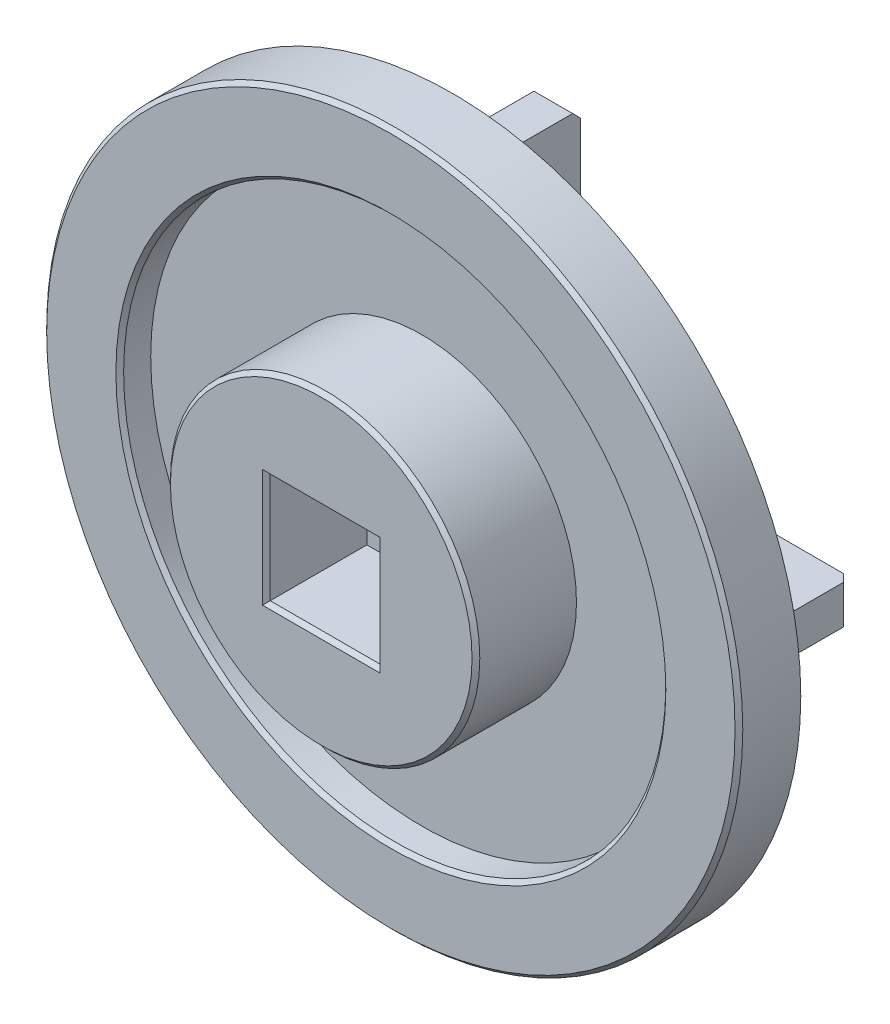
from build123d import *

# Parameters (mm, degrees)
SKETCH1_R           = 45
BOSS_EXTRUDE1_DEPTH = 8
SKETCH2_R           = 35.05
CUT_EXTRUDE1_DEPTH  = 4
SKETCH3_R           = 20
SKETCH3_W           = 14.2
SKETCH3_H           = 14.2
BOSS_EXTRUDE2_DEPTH = 13
CHAMFER1_SIZE       = 0.5
BOSS_EXTRUDE3_DEPTH = 14
CHAMFER3_SIZE       = 1
FILLET1_R           = 1


with BuildPart() as part:
    # Sketch1 → Boss-Extrude1 (new body)
    with BuildSketch(Plane.XY):
        Circle(SKETCH1_R)
    extrude(amount=BOSS_EXTRUDE1_DEPTH)

    # Sketch2 → Cut-Extrude1 (cut)
    with BuildSketch(Plane.XY.offset(8)):
        Circle(SKETCH2_R)
    extrude(amount=-CUT_EXTRUDE1_DEPTH, mode=Mode.SUBTRACT)

    # Sketch3 → Boss-Extrude2 (add)
    with BuildSketch(Plane.XY.offset(4)):
        with Locations(Location((0, 0, 0), (0, 0, 180))):
            Circle(SKETCH3_R)
        Rectangle(SKETCH3_W, SKETCH3_H, mode=Mode.SUBTRACT)
    extrude(amount=BOSS_EXTRUDE2_DEPTH)

    # Chamfer1
    chamfer1_edges = [part.edges().sort_by_distance(p)[0] for p in [
        (20, 0, 17),
        (-7.1, 0, 17),
        (0, -7.1, 17),
        (7.1, 0, 17),
        (0, 7.1, 17),
        (-45, 0, 8),
        (-35.05, 0, 8),
    ]]
    chamfer(chamfer1_edges, length=CHAMFER1_SIZE)

    # Sketch4 → Boss-Extrude3 (add)
    with BuildSketch(Plane(origin=(0, 0, 0), x_dir=(-1, 0, 0), z_dir=(0, 0, -1))):
        Polygon((-2.5, 2.5), (-37.5, 2.5), (-37.5, -2.5), (-2.5, -2.5), (-2.5, -37.5), (2.5, -37.5), (2.5, -2.5), (37.5, -2.5), (37.5, 2.5), (2.5, 2.5), (2.5, 37.5), (-2.5, 37.5), align=None)
    extrude(amount=BOSS_EXTRUDE3_DEPTH)

    # Chamfer3
    chamfer3_edges = [part.edges().sort_by_distance(p)[0] for p in [
        (0, 37.5, -14),
        (37.5, 0, -14),
        (0, -37.5, -14),
        (-37.5, 0, -14),
    ]]
    chamfer(chamfer3_edges, length=CHAMFER3_SIZE)

    # Fillet1
    fillet1_edges = [part.edges().sort_by_distance(p)[0] for p in [
        (-2.5, 2.5, -7),
        (2.5, 2.5, -7),
        (2.5, -2.5, -7),
        (-2.5, -2.5, -7),
    ]]
    fillet(fillet1_edges, radius=FILLET1_R)


solid = part.part
